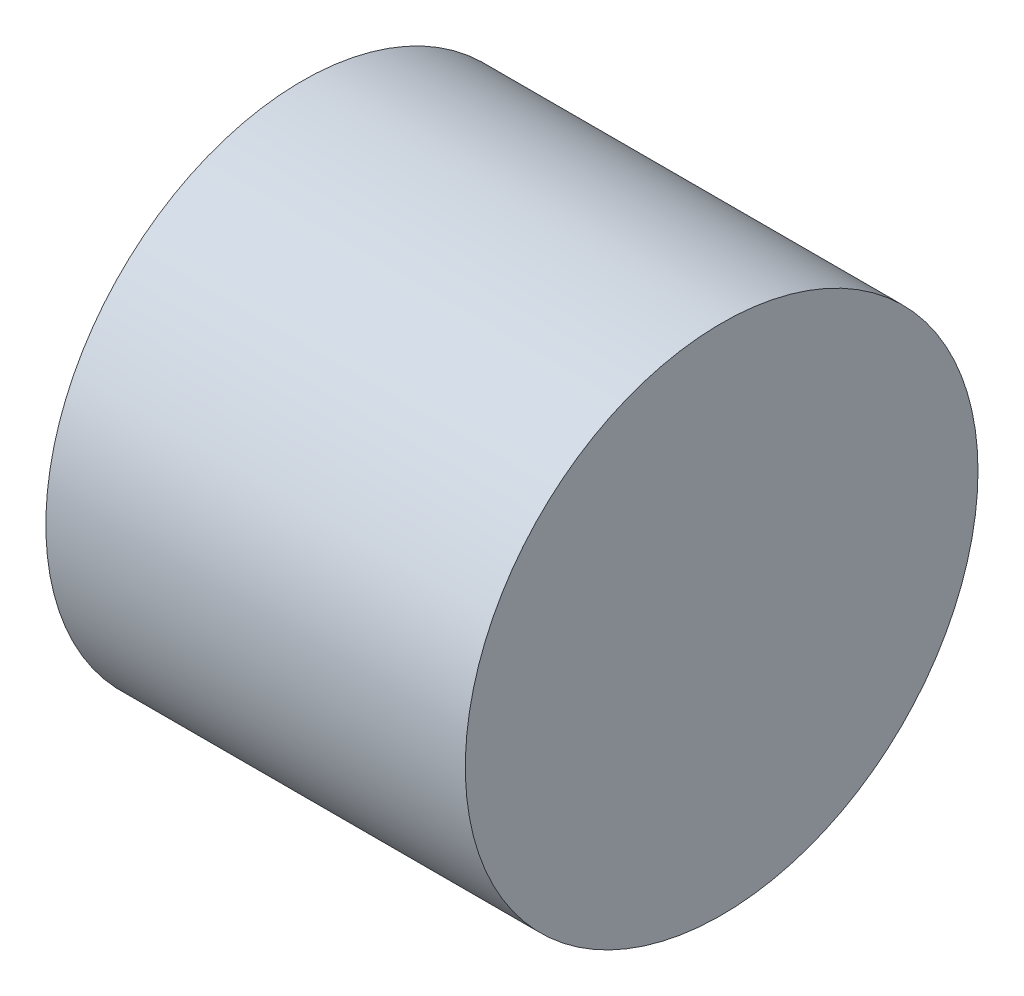
from build123d import *

# Parameters (mm, degrees)
SKETCH_1_R      = 275
EXTRUDE_1_DEPTH = 450


with BuildPart() as part:
    # 草图1 → 凸台-拉伸1 (new body)
    with BuildSketch(Plane(origin=(0, 0, 0), x_dir=(0, 0, -1), z_dir=(1, 0, 0))):
        Circle(SKETCH_1_R)
    extrude(amount=EXTRUDE_1_DEPTH)


solid = part.part
